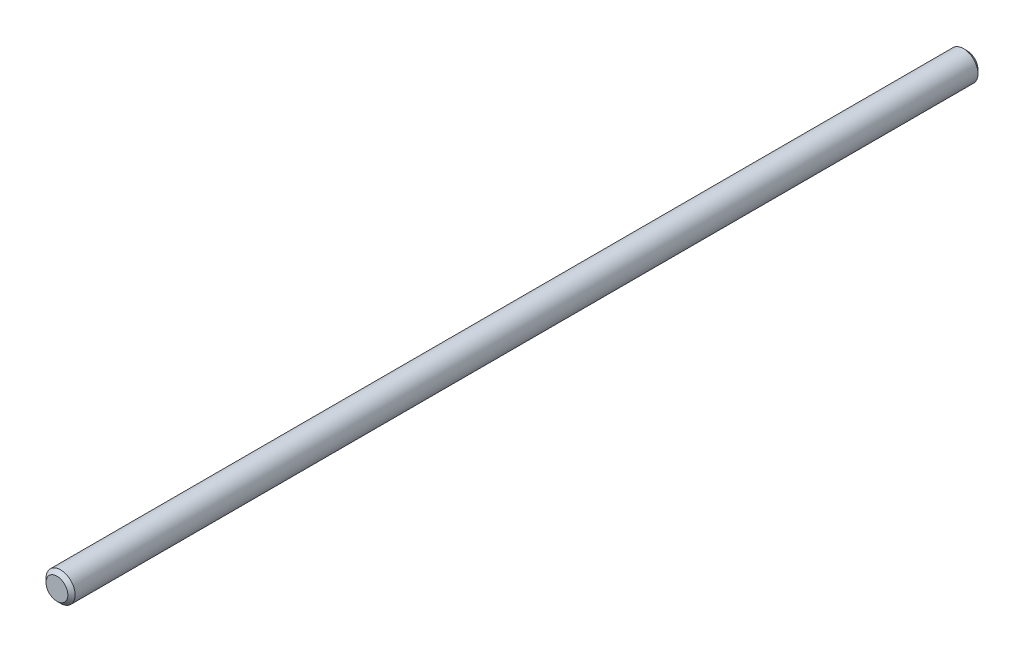
from build123d import *

# Parameters (mm, degrees)
SKETCH_1_R      = 2
EXTRUDE_1_DEPTH = 125
CHAMFER_1_SIZE  = 0.5


with BuildPart() as part:
    # 草图1 → 凸台-拉伸1 (new body)
    with BuildSketch(Plane.XY):
        Circle(SKETCH_1_R)
    extrude(amount=-EXTRUDE_1_DEPTH)

    # 倒角1
    chamfer_1_edges = [part.edges().sort_by_distance(p)[0] for p in [
        (-2, 0, 0),
        (-2, 0, -125),
    ]]
    chamfer(chamfer_1_edges, length=CHAMFER_1_SIZE)


solid = part.part
